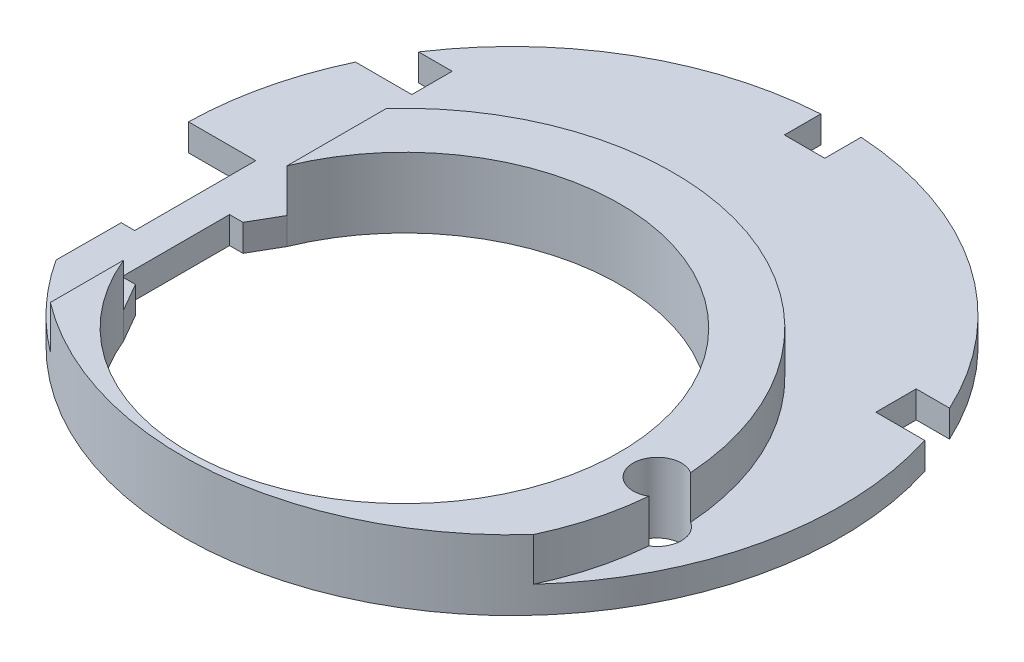
from build123d import *

# Parameters (mm, degrees)
BOSS_EXTRUDE1_DEPTH     = 1
BOSS_EXTRUDE2_DEPTH     = 1.6
CUT_EXTRUDE1_DEPTH      = 18.397844694
CUT_EXTRUDE1_DEPTH_BACK = 18.397844694
SKETCH2_R               = 0.9


with BuildPart() as part:
    # Sketch1 → Boss-Extrude1 (new body)
    with BuildSketch(Plane(origin=(0, 0, 0), x_dir=(1, 0, 0), z_dir=(0, 1, 0))):
        with BuildLine():
            Line((-0.75, 10.875), (-0.75, 12.227019261))
            ThreePointArc((-0.75, 12.227019261), (-6.131762108, 10.604904217), (-10.22252415, 6.75))
            Line((-10.22252415, 6.75), (-8.975, 6.75))
            Line((-8.975, 6.75), (-8.975, 5.25))
            Line((-8.975, 5.25), (-11.067971811, 5.25))
            ThreePointArc((-11.067971811, 5.25), (-12.238613585, 0.52805067), (-11.479034226, -4.277180525))
            Line((-11.479034226, -4.277180525), (-10.251454559, -4.277180525))
            Line((-10.251454559, -4.277180525), (-10.261976171, -6.689868838))
            ThreePointArc((-10.261976171, -6.689868838), (5.21925282, -11.08250423), (11.693587987, 3.65))
            Line((11.693587987, 3.65), (9.875, 3.65))
            Line((9.875, 3.65), (9.875, 5.15))
            Line((9.875, 5.15), (11.114854925, 5.15))
            ThreePointArc((11.114854925, 5.15), (6.90758612, 10.116706678), (0.75, 12.227019261))
            Line((0.75, 12.227019261), (0.75, 10.875))
            Line((0.75, 10.875), (-0.75, 10.875))
        make_face()
    extrude(amount=BOSS_EXTRUDE1_DEPTH)

    # Sketch3 → Boss-Extrude2 (add)
    with BuildSketch(Plane(origin=(0, 1, 0), x_dir=(1, 0, 0), z_dir=(0, 1, 0))):
        with BuildLine():
            Line((-7.400720069, 2.725276386), (-7.400720069, -0.962016711))
            ThreePointArc((-7.400720069, -0.962016711), (1.548263455, 3.848750237), (8, -4))
            ThreePointArc((8, -4), (1.548263455, -11.848750237), (-7.400720069, -7.037983289))
            Line((-7.400720069, -7.037983289), (-7.400720069, -9.761754067))
            ThreePointArc((-7.400720069, -9.761754067), (1.115373522, -12.19911644), (9.048261309, -8.2578125))
            ThreePointArc((9.048261309, -8.2578125), (9.759165259, -6.181442975), (10, -4))
            ThreePointArc((10, -4), (3.605051963, 5.32757205), (-7.400720069, 2.725276386))
        make_face()
    extrude(amount=BOSS_EXTRUDE2_DEPTH)

    # Sketch2 → Cut-Extrude1 (cut, two sides: drawn at the far end of the back side and taken through both)
    with BuildSketch(Plane(origin=(0, 1, 0), x_dir=(1, 0, 0), z_dir=(0, 1, 0)).offset(-CUT_EXTRUDE1_DEPTH_BACK)):
        with BuildLine():
            Line((-11.479034226, -4.277180525), (-9.747973362, -4.277180525))
            Line((-9.747973362, -4.277180525), (-9.747973362, 0.222819475))
            Line((-9.747973362, 0.222819475), (-12.247973362, 0.222819475))
            ThreePointArc((-12.247973362, 0.222819475), (-12.074983324, -2.063317167), (-11.479034226, -4.277180525))
        make_face()
        with BuildLine():
            ThreePointArc((-7.400720069, -7.037983289), (8, -4), (-7.400720069, -0.962016711))
            Line((-7.400720069, -0.962016711), (-8, -2))
            Line((-8, -2), (-8.5, -2))
            Line((-8.5, -2), (-8.5, -6))
            Line((-8.5, -6), (-8, -6))
            Line((-8, -6), (-7.400720069, -7.037983289))
        make_face()
        with Locations(Location((9.5, -4.1, 0), (0, 0, 270))):
            Circle(SKETCH2_R)
    extrude(amount=CUT_EXTRUDE1_DEPTH + CUT_EXTRUDE1_DEPTH_BACK, mode=Mode.SUBTRACT)


solid = part.part
